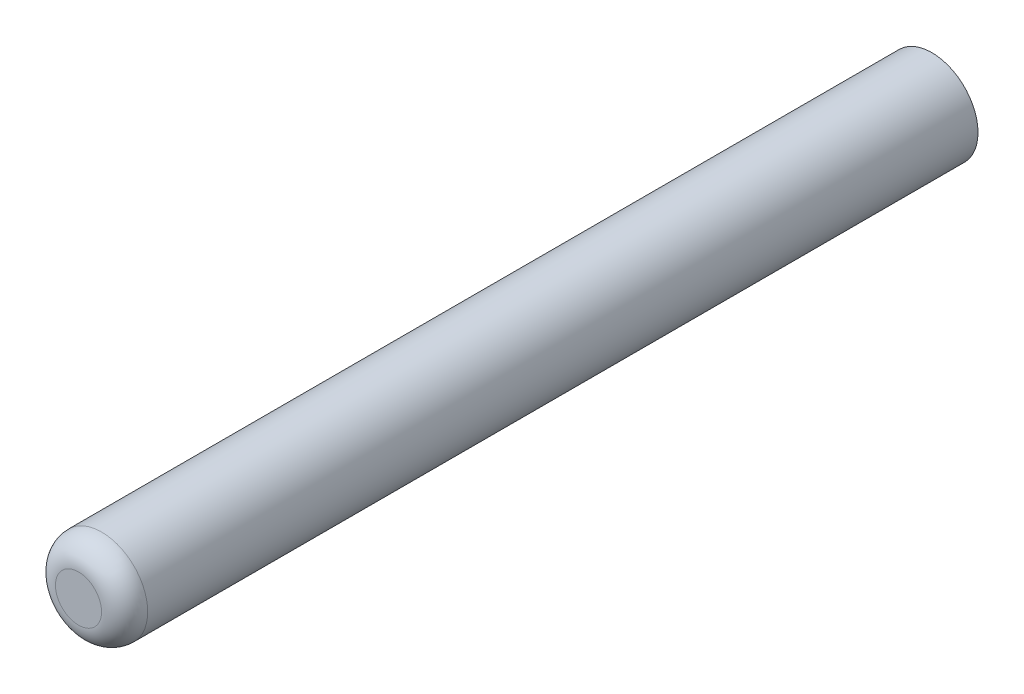
from build123d import *

# Parameters (mm, degrees)
SKETCH1_R           = 2
BOSS_EXTRUDE1_DEPTH = 37
FILLET1_R           = 1


with BuildPart() as part:
    # Sketch1 → Boss-Extrude1 (new body)
    with BuildSketch(Plane.XY):
        with Locations((-33.053163921, 3.490085631)):
            Circle(SKETCH1_R)
    extrude(amount=BOSS_EXTRUDE1_DEPTH)

    # Fillet1
    fillet1_edges = [part.edges().sort_by_distance(p)[0] for p in [
        (-35.053163921, 3.490085631, 37),
    ]]
    fillet(fillet1_edges, radius=FILLET1_R)


solid = part.part
